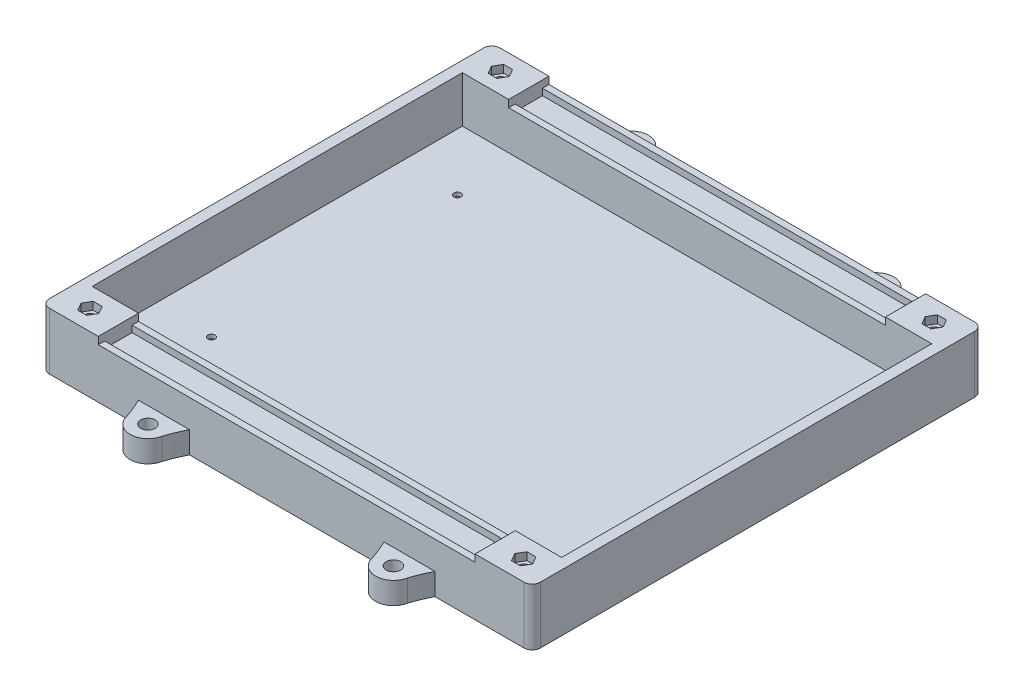
from build123d import *

# Parameters (mm, degrees)
SKETCH18_W              = 228.04
SKETCH18_H              = 171.92
BOSS_EXTRUDE6_DEPTH     = 26.5
SKETCH20_W              = 218.04
SKETCH20_H              = 171.92
CUT_EXTRUDE6_DEPTH      = 21.5
SKETCH22_W              = 228.04
SKETCH22_H              = 18.7
BOSS_EXTRUDE7_DEPTH     = 26.5
SKETCH23_W              = 228.04
SKETCH23_H              = 18.7
BOSS_EXTRUDE8_DEPTH     = 26.5
SKETCH24_W              = 175
SKETCH24_H              = 18.7
CUT_EXTRUDE7_DEPTH      = 3.35
SKETCH25_W              = 175
SKETCH25_H              = 18.7
CUT_EXTRUDE8_DEPTH      = 3.35
SKETCH27_W              = 175
SKETCH27_H              = 12.7
CUT_EXTRUDE9_DEPTH      = 3
SKETCH28_W              = 175
SKETCH28_H              = 12.7
CUT_EXTRUDE10_DEPTH     = 3
SKETCH31_R              = 1.65
SKETCH31_R_2            = 1.651
CUT_EXTRUDE15_DEPTH     = 1.825
CUT_EXTRUDE17_DEPTH     = 3.175
SKETCH39_R              = 2.2
CUT_EXTRUDE18_DEPTH     = 26.5
SKETCH40_R              = 4.4
CUT_EXTRUDE19_DEPTH     = 20.9
FILLET1_R               = 3.81
CUT_EXTRUDE20_DEPTH     = 3.6
SKETCH47_R              = 3.3782
BOSS_EXTRUDE14_DEPTH    = 10.16
MIRROR8_COPY_1_SKETCH_R = 2.2
MIRROR8_COPY_1_DEPTH    = 26.5
MIRROR8_COPY_2_SKETCH_R = 4.4
MIRROR8_COPY_2_DEPTH    = 20.9
MIRROR8_COPY_3_DEPTH    = 3.6


with BuildPart() as part:
    # Sketch18 → Boss-Extrude6 (new body)
    with BuildSketch(Plane(origin=(0, 0, 0), x_dir=(1, 0, 0), z_dir=(0, 1, 0))):
        Rectangle(SKETCH18_W, SKETCH18_H)
    extrude(amount=BOSS_EXTRUDE6_DEPTH)

    # Sketch20 → Cut-Extrude6 (cut)
    with BuildSketch(Plane(origin=(0, 26.5, 0), x_dir=(1, 0, 0), z_dir=(0, 1, 0))):
        Rectangle(SKETCH20_W, SKETCH20_H)
    extrude(amount=-CUT_EXTRUDE6_DEPTH, mode=Mode.SUBTRACT)

    # Sketch22 → Boss-Extrude7 (add)
    with BuildSketch(Plane(origin=(0, 0, 0), x_dir=(1, 0, 0), z_dir=(0, 1, 0))):
        with Locations((0, -95.31)):
            Rectangle(SKETCH22_W, SKETCH22_H)
    extrude(amount=BOSS_EXTRUDE7_DEPTH)

    # Sketch23 → Boss-Extrude8 (add)
    with BuildSketch(Plane(origin=(0, 0, 0), x_dir=(1, 0, 0), z_dir=(0, 1, 0))):
        with Locations((0, 95.31)):
            Rectangle(SKETCH23_W, SKETCH23_H)
    extrude(amount=BOSS_EXTRUDE8_DEPTH)

    # Sketch24 → Cut-Extrude7 (cut)
    with BuildSketch(Plane(origin=(0, 26.5, 0), x_dir=(1, 0, 0), z_dir=(0, 1, 0))):
        with Locations((0, 95.31)):
            Rectangle(SKETCH24_W, SKETCH24_H)
    extrude(amount=-CUT_EXTRUDE7_DEPTH, mode=Mode.SUBTRACT)

    # Sketch25 → Cut-Extrude8 (cut)
    with BuildSketch(Plane(origin=(0, 26.5, 0), x_dir=(1, 0, 0), z_dir=(0, 1, 0))):
        with Locations((0, -95.31)):
            Rectangle(SKETCH25_W, SKETCH25_H)
    extrude(amount=-CUT_EXTRUDE8_DEPTH, mode=Mode.SUBTRACT)

    # Sketch27 → Cut-Extrude9 (cut)
    with BuildSketch(Plane(origin=(0, 23.15, 0), x_dir=(1, 0, 0), z_dir=(0, 1, 0))):
        with Locations((0, -95.31)):
            Rectangle(SKETCH27_W, SKETCH27_H)
    extrude(amount=-CUT_EXTRUDE9_DEPTH, mode=Mode.SUBTRACT)

    # Sketch28 → Cut-Extrude10 (cut)
    with BuildSketch(Plane(origin=(0, 23.15, 0), x_dir=(1, 0, 0), z_dir=(0, 1, 0))):
        with Locations((0, 95.31)):
            Rectangle(SKETCH28_W, SKETCH28_H)
    extrude(amount=-CUT_EXTRUDE10_DEPTH, mode=Mode.SUBTRACT)

    # Sketch31 → Cut-Extrude15 (cut)
    with BuildSketch(Plane(origin=(0, 5, 0), x_dir=(1, 0, 0), z_dir=(0, 1, 0))):
        with Locations((-82.448, 57.15)):
            Circle(SKETCH31_R)
        with Locations((101.448, 57.15)):
            Circle(SKETCH31_R_2)
        with Locations((101.448, -57.15)):
            Circle(SKETCH31_R_2)
        with Locations((-82.448, -57.15)):
            Circle(SKETCH31_R)
    extrude(amount=-CUT_EXTRUDE15_DEPTH, mode=Mode.SUBTRACT)

    # Sketch33 → Cut-Extrude17 (cut)
    with BuildSketch(Plane.XZ):
        Polygon((-79.316971755, -58.9577), (-79.316971755, -55.3423), (-82.448, -53.5346), (-85.579028245, -55.3423), (-85.579028245, -58.9577), (-82.448, -60.7654), align=None)
        Polygon((104.579028245, -58.9577), (104.579028245, -55.3423), (101.448, -53.5346), (98.316971755, -55.3423), (98.316971755, -58.9577), (101.448, -60.7654), align=None)
        Polygon((-79.316971755, 58.9577), (-82.448, 60.7654), (-85.579028245, 58.9577), (-85.579028245, 55.3423), (-82.448, 53.5346), (-79.316971755, 55.3423), align=None)
        Polygon((98.316971755, 58.9577), (98.316971755, 55.3423), (101.448, 53.5346), (104.579028245, 55.3423), (104.579028245, 58.9577), (101.448, 60.7654), align=None)
    extrude(amount=-CUT_EXTRUDE17_DEPTH, mode=Mode.SUBTRACT)

    # Sketch39 → Cut-Extrude18 (cut)
    with BuildSketch(Plane(origin=(0, 26.5, 0), x_dir=(1, 0, 0), z_dir=(0, 1, 0))):
        with Locations((100.76, 95.31)):
            Circle(SKETCH39_R)
    cut_extrude18 = extrude(amount=-CUT_EXTRUDE18_DEPTH, mode=Mode.SUBTRACT)

    # Sketch40 → Cut-Extrude19 (cut)
    with BuildSketch(Plane.XZ):
        with Locations((100.76, -95.31)):
            Circle(SKETCH40_R)
    cut_extrude19 = extrude(amount=-CUT_EXTRUDE19_DEPTH, mode=Mode.SUBTRACT)

    # Mirror3: Cut-Extrude18 across plane
    add(cut_extrude18.mirror(Plane.XY), mode=Mode.SUBTRACT)

    # Mirror4: Cut-Extrude19 across plane
    add(cut_extrude19.mirror(Plane.XY), mode=Mode.SUBTRACT)

    # Fillet1
    fillet1_edges = [part.edges().sort_by_distance(p)[0] for p in [
        (114.02, 13.25, 104.66),
        (-114.02, 13.25, 104.66),
        (-114.02, 13.25, -104.66),
        (114.02, 13.25, -104.66),
    ]]
    fillet(fillet1_edges, radius=FILLET1_R)

    # Sketch41 → Cut-Extrude20 (cut)
    with BuildSketch(Plane(origin=(0, 26.5, 0), x_dir=(1, 0, 0), z_dir=(0, 1, 0))):
        Polygon((98.681539031, -91.71), (96.603078062, -95.31), (98.681539031, -98.91), (102.838460969, -98.91), (104.916921938, -95.31), (102.838460969, -91.71), align=None)
    cut_extrude20 = extrude(amount=-CUT_EXTRUDE20_DEPTH, mode=Mode.SUBTRACT)

    # Mirror5: Cut-Extrude20 across plane
    add(cut_extrude20.mirror(Plane.XY), mode=Mode.SUBTRACT)

    # Sketch47 → Boss-Extrude14 (add)
    # profile 1 of 2: a face of its own
    with BuildSketch(Plane.XZ):
        with BuildLine():
            ThreePointArc((45.13728714, -104.66), (47.210651626, -109.12978233), (48.903154853, -113.757225166))
            ThreePointArc((48.903154853, -113.757225166), (57.01, -120.350559583), (65.116845147, -113.757225166))
            ThreePointArc((65.116845147, -113.757225166), (66.809348374, -109.12978233), (68.88271286, -104.66))
            Line((68.88271286, -104.66), (57.122870876, -104.66))
            Line((57.122870876, -104.66), (45.13728714, -104.66))
        make_face()
        with Locations((57.01, -112.07)):
            Circle(SKETCH47_R, mode=Mode.SUBTRACT)
    # profile 2 of 2: a face of its own
    with BuildSketch(Plane.XZ):
        with BuildLine():
            ThreePointArc((-48.903154853, -113.757225166), (-47.210651626, -109.12978233), (-45.13728714, -104.66))
            Line((-45.13728714, -104.66), (-57.122870876, -104.66))
            Line((-57.122870876, -104.66), (-68.88271286, -104.66))
            ThreePointArc((-68.88271286, -104.66), (-66.809348374, -109.12978233), (-65.116845147, -113.757225166))
            ThreePointArc((-65.116845147, -113.757225166), (-57.01, -120.350559583), (-48.903154853, -113.757225166))
        make_face()
        with Locations((-57.01, -112.07)):
            Circle(SKETCH47_R, mode=Mode.SUBTRACT)
    boss_extrude14 = extrude(amount=-BOSS_EXTRUDE14_DEPTH)

    # Mirror6: Boss-Extrude14 across plane
    add(boss_extrude14.mirror(Plane.XY))

    # Mirror8: Cut-Extrude18, Cut-Extrude19, Cut-Extrude20 across plane
    add(cut_extrude18.mirror(Plane.ZY.offset(-0.02)), mode=Mode.SUBTRACT)
    add(cut_extrude19.mirror(Plane.ZY.offset(-0.02)), mode=Mode.SUBTRACT)
    add(cut_extrude20.mirror(Plane.ZY.offset(-0.02)), mode=Mode.SUBTRACT)

    # Mirror8 copy 1 sketch → Mirror8 copy 1 (cut)
    with BuildSketch(Plane(origin=(0.04, 26.5, 0), x_dir=(-1, 0, 0), z_dir=(0, 1, 0))):
        with Locations((100.76, 95.31)):
            Circle(MIRROR8_COPY_1_SKETCH_R)
    extrude(amount=-MIRROR8_COPY_1_DEPTH, mode=Mode.SUBTRACT)

    # Mirror8 copy 2 sketch → Mirror8 copy 2 (cut)
    with BuildSketch(Plane(origin=(0.04, 0, 0), x_dir=(-1, 0, 0), z_dir=(0, -1, 0))):
        with Locations((100.76, -95.31)):
            Circle(MIRROR8_COPY_2_SKETCH_R)
    extrude(amount=-MIRROR8_COPY_2_DEPTH, mode=Mode.SUBTRACT)

    # Mirror8 copy 3 sketch → Mirror8 copy 3 (cut)
    with BuildSketch(Plane(origin=(0.04, 26.5, 0), x_dir=(-1, 0, 0), z_dir=(0, 1, 0))):
        Polygon((98.681539031, -91.71), (96.603078062, -95.31), (98.681539031, -98.91), (102.838460969, -98.91), (104.916921938, -95.31), (102.838460969, -91.71), align=None)
    extrude(amount=-MIRROR8_COPY_3_DEPTH, mode=Mode.SUBTRACT)


solid = part.part
